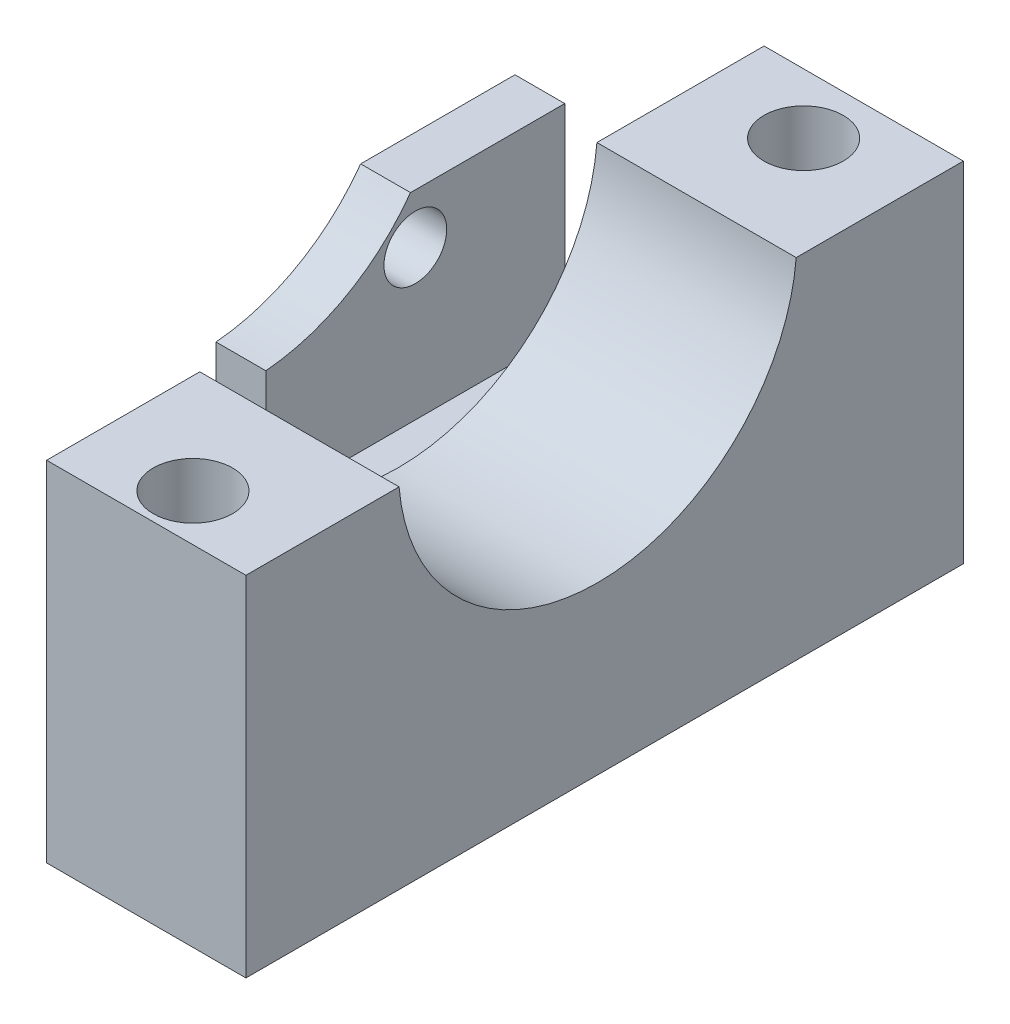
from build123d import *

# Parameters (mm, degrees)
SKETCH1_W                      = 9.525
SKETCH1_H                      = 19.05
SKETCH1_W_2                    = 3.175
BOSS_EXTRUDE1_DEPTH            = 3.175
BOSS_EXTRUDE2_START            = 3.175
SKETCH1_3_W                    = 3.175
SKETCH1_3_H                    = 19.05
BOSS_EXTRUDE2_DEPTH            = 12.7
SKETCH2_R                      = 2
CUT_EXTRUDE1_DEPTH             = 21.819867315
SKETCH4_W                      = 12.7
SKETCH4_H                      = 45.72
BOSS_EXTRUDE3_DEPTH            = 22.225
SKETCH3_R                      = 12.7
CUT_EXTRUDE2_DEPTH             = 48.21685107
F_8_0_199_DIAMETER_HOLE1_D     = 5.0546
F_8_0_199_DIAMETER_HOLE1_DEPTH = 61.468
F_8_0_199_DIAMETER_HOLE1_TIP   = 1.518555042


with BuildPart() as part:
    # Sketch1 → Boss-Extrude1 (new body)
    with BuildSketch(Plane(origin=(0, 0, 0), x_dir=(1, 0, 0), z_dir=(0, 1, 0))):
        with Locations((1.5875, 0)):
            Rectangle(SKETCH1_W, SKETCH1_H)
        with Locations((-4.7625, 0)):
            Rectangle(SKETCH1_W_2, SKETCH1_H)
    extrude(amount=BOSS_EXTRUDE1_DEPTH)

    # Sketch1<3> → Boss-Extrude2 (add)
    with BuildSketch(Plane(origin=(0, 0, 0), x_dir=(1, 0, 0), z_dir=(0, 1, 0)).offset(BOSS_EXTRUDE2_START)):
        with Locations((-4.7625, 0)):
            Rectangle(SKETCH1_3_W, SKETCH1_3_H)
    extrude(amount=BOSS_EXTRUDE2_DEPTH)

    # Sketch2 → Cut-Extrude1 (cut, through all)
    with BuildSketch(Plane(origin=(-3.175, 0, 0), x_dir=(0, 0, -1), z_dir=(1, 0, 0))):
        with Locations((0, 12.7)):
            Circle(SKETCH2_R)
    extrude(amount=-CUT_EXTRUDE1_DEPTH, mode=Mode.SUBTRACT)

    # Sketch4 → Boss-Extrude3 (add)
    with BuildSketch(Plane.XZ):
        with Locations((12.7, 10.16)):
            Rectangle(SKETCH4_W, SKETCH4_H)
    extrude(amount=-BOSS_EXTRUDE3_DEPTH)

    # Sketch3 → Cut-Extrude2 (cut, through all)
    with BuildSketch(Plane.ZY.offset(6.35)):
        with Locations((10.606601718, 23.306601718)):
            Circle(SKETCH3_R)
    extrude(amount=-CUT_EXTRUDE2_DEPTH, mode=Mode.SUBTRACT)

    # #8 (0.199) Diameter Hole1
    with Locations(Plane(origin=(0, 22.225, 0), x_dir=(1, 0, 0), z_dir=(0, 1, 0))):
        with Locations((12.7, 8.868531542), (12.7, -30.047302209)):
            Hole(F_8_0_199_DIAMETER_HOLE1_D / 2, depth=F_8_0_199_DIAMETER_HOLE1_DEPTH)
            with Locations((0, 0, -(F_8_0_199_DIAMETER_HOLE1_DEPTH + F_8_0_199_DIAMETER_HOLE1_TIP / 2))):  # 118° drill point
                Cone(0, F_8_0_199_DIAMETER_HOLE1_D / 2, F_8_0_199_DIAMETER_HOLE1_TIP, mode=Mode.SUBTRACT)


solid = part.part
